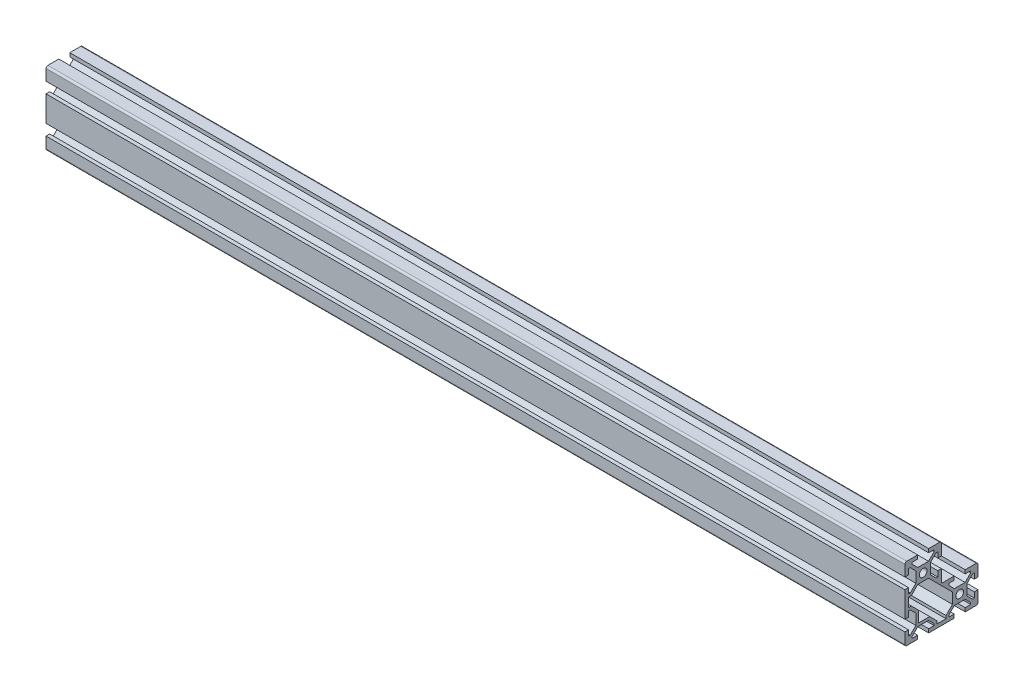
from build123d import *

# Parameters (mm, degrees)
SKETCH1_R           = 2.1
BOSS_EXTRUDE1_DEPTH = 470
SKETCH10_R          = 2.1
BOSS_EXTRUDE4_DEPTH = 15
BOSS_EXTRUDE5_START = -15
SKETCH11_R          = 2.1
BOSS_EXTRUDE5_DEPTH = 15
TAPPED_HOLE3_D      = 4.2
TAPPED_HOLE3_DEPTH  = 15
TAPPED_HOLE4_D      = 4.2


with BuildPart() as part:
    # Sketch1 → Boss-Extrude1 (new body)
    with BuildSketch(Plane(origin=(0, 0, 0), x_dir=(0, 0, -1), z_dir=(1, 0, 0))):
        with BuildLine():
            Line((-13, 18), (-13, 20))
            Line((-13, 20), (-19, 20))
            ThreePointArc((-19, 20), (-19.707106781, 19.707106781), (-20, 19))
            Line((-20, 19), (-20, 13))
            Line((-20, 13), (-18, 13))
            Line((-18, 13), (-18, 16))
            Line((-18, 16), (-17.060660172, 16))
            Line((-17.060660172, 16), (-14, 12.939339828))
            Line((-14, 12.939339828), (-14, 7.060660172))
            Line((-14, 7.060660172), (-17.060660172, 4))
            Line((-17.060660172, 4), (-18, 4))
            Line((-18, 4), (-18, 7))
            Line((-18, 7), (-20, 7))
            Line((-20, 7), (-20, -7))
            Line((-20, -7), (-18, -7))
            Line((-18, -7), (-18, -4))
            Line((-18, -4), (-17.060660172, -4))
            Line((-17.060660172, -4), (-14, -7.060660172))
            Line((-14, -7.060660172), (-14, -12.939339828))
            Line((-14, -12.939339828), (-17.060660172, -16))
            Line((-17.060660172, -16), (-18, -16))
            Line((-18, -16), (-18, -13))
            Line((-18, -13), (-20, -13))
            Line((-20, -13), (-20, -19))
            ThreePointArc((-20, -19), (-19.707106781, -19.707106781), (-19, -20))
            Line((-19, -20), (-13, -20))
            Line((-13, -20), (-13, -18))
            Line((-13, -18), (-16, -18))
            Line((-16, -18), (-16, -17.060660172))
            Line((-16, -17.060660172), (-12.939339828, -14))
            Line((-12.939339828, -14), (-7.060660172, -14))
            Line((-7.060660172, -14), (-4, -17.060660172))
            Line((-4, -17.060660172), (-4, -18))
            Line((-4, -18), (-7, -18))
            Line((-7, -18), (-7, -20))
            Line((-7, -20), (7, -20))
            Line((7, -20), (7, -18))
            Line((7, -18), (4, -18))
            Line((4, -18), (4, -17.060660172))
            Line((4, -17.060660172), (7.060660172, -14))
            Line((7.060660172, -14), (12.939339828, -14))
            Line((12.939339828, -14), (16, -17.060660172))
            Line((16, -17.060660172), (16, -18))
            Line((16, -18), (13, -18))
            Line((13, -18), (13, -20))
            Line((13, -20), (19, -20))
            ThreePointArc((19, -20), (19.707106781, -19.707106781), (20, -19))
            Line((20, -19), (20, -13))
            Line((20, -13), (18, -13))
            Line((18, -13), (18, -16))
            Line((18, -16), (17.060660172, -16))
            Line((17.060660172, -16), (14, -12.939339828))
            Line((14, -12.939339828), (14, -7.060660172))
            Line((14, -7.060660172), (17.060660172, -4))
            Line((17.060660172, -4), (18, -4))
            Line((18, -4), (18, -7))
            Line((18, -7), (20, -7))
            Line((20, -7), (20, -1))
            ThreePointArc((20, -1), (19.707106781, -0.292893219), (19, 0))
            Line((19, 0), (13, 0))
            Line((13, 0), (13, -2))
            Line((13, -2), (16, -2))
            Line((16, -2), (16, -2.939339828))
            Line((16, -2.939339828), (12.939339828, -6))
            Line((12.939339828, -6), (7.060660172, -6))
            Line((7.060660172, -6), (4, -2.939339828))
            Line((4, -2.939339828), (4, -2))
            Line((4, -2), (7, -2))
            Line((7, -2), (7, 0))
            Line((7, 0), (0.3, 0))
            ThreePointArc((0.3, 0), (0.087867966, 0.087867966), (0, 0.3))
            Line((0, 0.3), (0, 7))
            Line((0, 7), (-2, 7))
            Line((-2, 7), (-2, 4))
            Line((-2, 4), (-2.939339828, 4))
            Line((-2.939339828, 4), (-6, 7.060660172))
            Line((-6, 7.060660172), (-6, 12.939339828))
            Line((-6, 12.939339828), (-2.939339828, 16))
            Line((-2.939339828, 16), (-2, 16))
            Line((-2, 16), (-2, 13))
            Line((-2, 13), (0, 13))
            Line((0, 13), (0, 19))
            ThreePointArc((0, 19), (-0.292893219, 19.707106781), (-1, 20))
            Line((-1, 20), (-7, 20))
            Line((-7, 20), (-7, 18))
            Line((-7, 18), (-4, 18))
            Line((-4, 18), (-4, 17.060660172))
            Line((-4, 17.060660172), (-7.060660172, 14))
            Line((-7.060660172, 14), (-12.939339828, 14))
            Line((-12.939339828, 14), (-16, 17.060660172))
            Line((-16, 17.060660172), (-16, 18))
            Line((-16, 18), (-13, 18))
        make_face()
        with Locations(Location((10, -10, 0), (0, 0, 180))):
            Circle(SKETCH1_R, mode=Mode.SUBTRACT)
        with Locations(Location((-10, 10, 0), (0, 0, 180))):
            Circle(SKETCH1_R, mode=Mode.SUBTRACT)
        Polygon((6, -7.060660172), (-7.060660172, 6), (-12.939339828, 6), (-16.439339828, 2.5), (-18, 2.5), (-18, -2.5), (-16.439339828, -2.5), (-12.5, -6.439339828), (-12.5, -12.5), (-6.439339828, -12.5), (-2.5, -16.439339828), (-2.5, -18), (2.5, -18), (2.5, -16.439339828), (6, -12.939339828), align=None, mode=Mode.SUBTRACT)
    extrude(amount=BOSS_EXTRUDE1_DEPTH)

    # Sketch10 → Boss-Extrude4 (add)
    with BuildSketch(Plane(origin=(0, 0, 0), x_dir=(0, 0, -1), z_dir=(1, 0, 0))):
        with Locations(Location((10, -10, 0), (0, 0, 180))):
            Circle(SKETCH10_R)
        with Locations(Location((-10, 10, 0), (0, 0, 180))):
            Circle(SKETCH10_R)
    extrude(amount=BOSS_EXTRUDE4_DEPTH)

    # Sketch11 → Boss-Extrude5 (add)
    with BuildSketch(Plane(origin=(470, 0, 0), x_dir=(0, 0, -1), z_dir=(1, 0, 0)).offset(BOSS_EXTRUDE5_START)):
        with Locations(Location((10, -10, 0), (0, 0, 180))):
            Circle(SKETCH11_R)
        with Locations(Location((-10, 10, 0), (0, 0, 180))):
            Circle(SKETCH11_R)
    extrude(amount=BOSS_EXTRUDE5_DEPTH)

    # Tapped Hole3
    with Locations(Plane(origin=(0, 0, 42.543082138), x_dir=(0, 0, -1), z_dir=(-1, 0, 0))):
        with Locations((52.543082138, 10), (32.543082138, -10)):
            Hole(TAPPED_HOLE3_D / 2, depth=TAPPED_HOLE3_DEPTH)

    # Tapped Hole4 (through all)
    with Locations(Plane(origin=(470, 0, -41.216277394), x_dir=(0, 0, 1), z_dir=(1, 0, 0))):
        with Locations((51.216277394, -10), (31.216277394, 10)):
            Hole(TAPPED_HOLE4_D / 2)


solid = part.part
